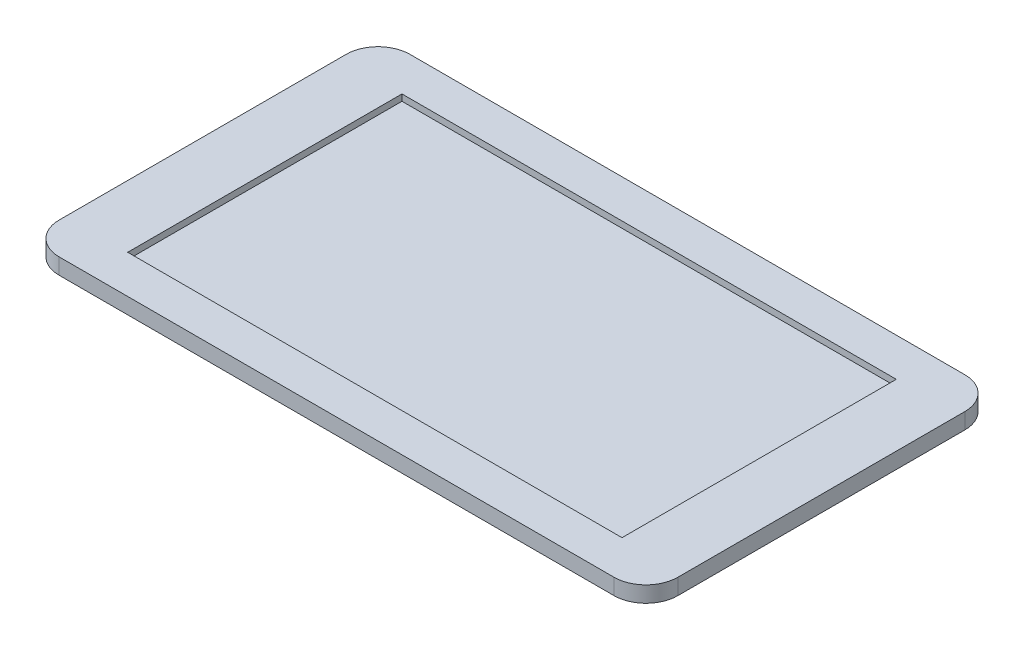
from build123d import *

# Parameters (mm, degrees)
SKETCH1_W           = 194
SKETCH1_H           = 110
BOSS_EXTRUDE1_DEPTH = 5
FILLET1_R           = 10
SKETCH2_W           = 155
SKETCH2_H           = 86
CUT_EXTRUDE1_DEPTH  = 2
SKETCH3_W           = 67.75
SKETCH3_H           = 58.75
SKETCH3_R           = 1.375
BOSS_EXTRUDE2_DEPTH = 5


with BuildPart() as part:
    # Sketch1 → Boss-Extrude1 (new body)
    with BuildSketch(Plane(origin=(0, 0, 0), x_dir=(1, 0, 0), z_dir=(0, 1, 0))):
        Rectangle(SKETCH1_W, SKETCH1_H)
    extrude(amount=-BOSS_EXTRUDE1_DEPTH)

    # Fillet1
    fillet1_edges = [part.edges().sort_by_distance(p)[0] for p in [
        (97, -2.5, 55),
        (-97, -2.5, 55),
        (-97, -2.5, -55),
        (97, -2.5, -55),
    ]]
    fillet(fillet1_edges, radius=FILLET1_R)

    # Sketch2 → Cut-Extrude1 (cut)
    with BuildSketch(Plane(origin=(0, 0, 0), x_dir=(1, 0, 0), z_dir=(0, 1, 0))):
        Rectangle(SKETCH2_W, SKETCH2_H)
    extrude(amount=-CUT_EXTRUDE1_DEPTH, mode=Mode.SUBTRACT)

    # Sketch3 → Boss-Extrude2 (add)
    with BuildSketch(Plane.XZ.offset(5)):
        Rectangle(SKETCH3_W, SKETCH3_H)
        with Locations(Location((-29, 24.5, 0), (0, 0, 270))):
            Circle(SKETCH3_R, mode=Mode.SUBTRACT)
        with Locations(Location((29, 24.5, 0), (0, 0, 270))):
            Circle(SKETCH3_R, mode=Mode.SUBTRACT)
        with Locations(Location((29, -24.5, 0), (0, 0, 270))):
            Circle(SKETCH3_R, mode=Mode.SUBTRACT)
        with Locations(Location((-29, -24.5, 0), (0, 0, 270))):
            Circle(SKETCH3_R, mode=Mode.SUBTRACT)
    extrude(amount=BOSS_EXTRUDE2_DEPTH)


solid = part.part
